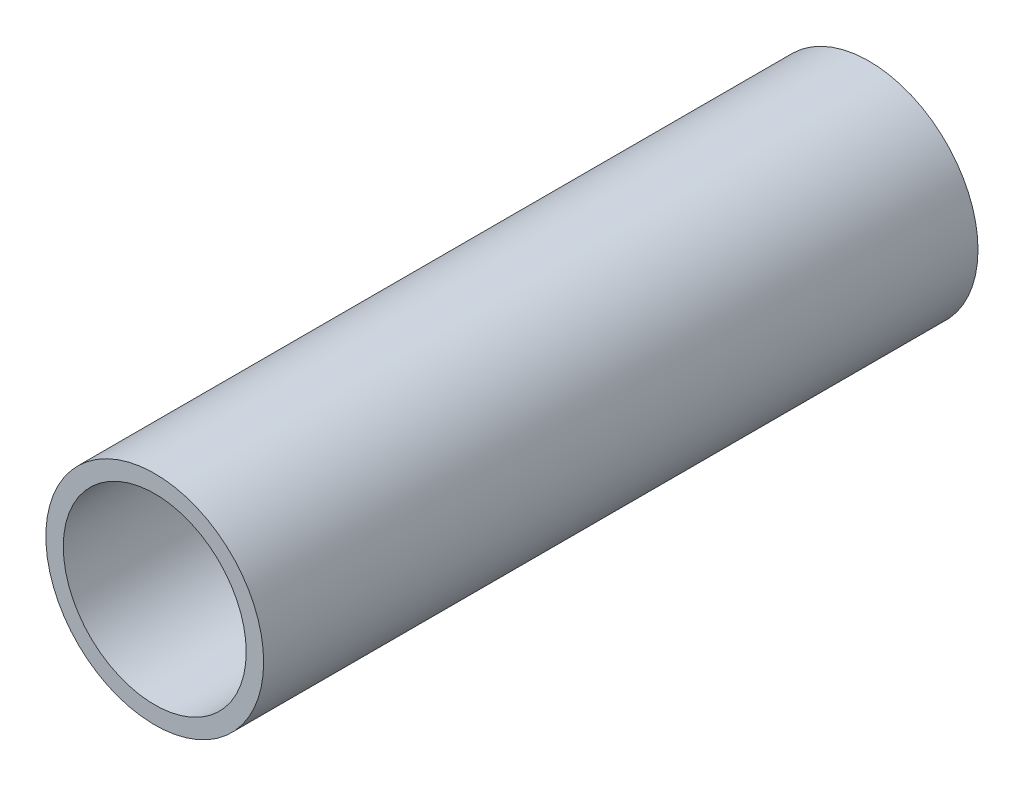
from build123d import *

# Parameters (mm, degrees)
SCHIZZO1_R                   = 12.5
SCHIZZO1_R_2                 = 10.5
ESTRUSIONE_ESTRUSIONE1_DEPTH = 82


with BuildPart() as part:
    # Schizzo1 → Estrusione-Estrusione1 (new body)
    with BuildSketch(Plane.XY):
        Circle(SCHIZZO1_R)
        Circle(SCHIZZO1_R_2, mode=Mode.SUBTRACT)
    extrude(amount=ESTRUSIONE_ESTRUSIONE1_DEPTH)


solid = part.part
